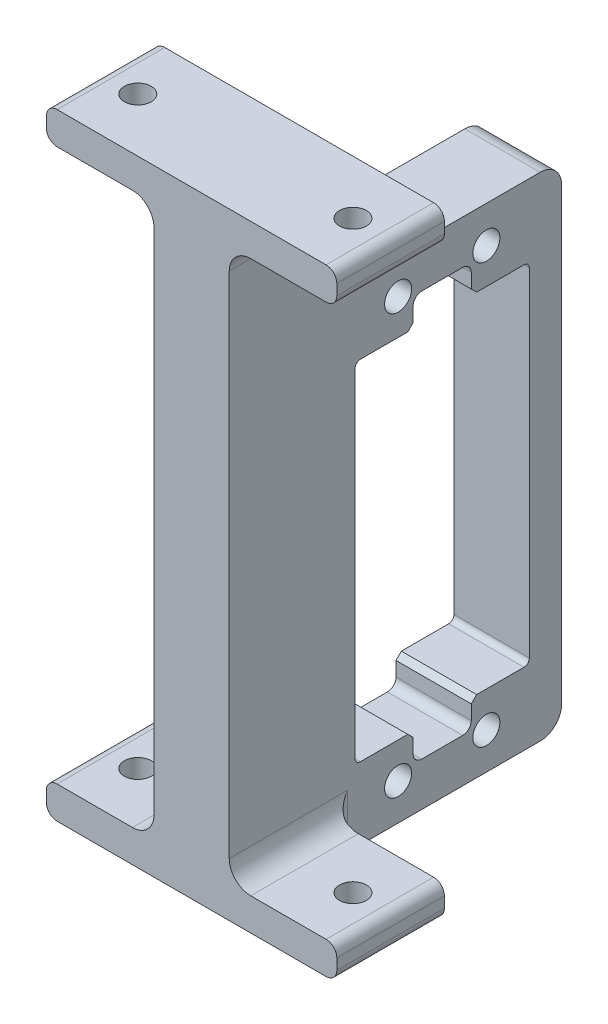
from build123d import *

# Parameters (mm, degrees)
FRAME_MOUNT_DEPTH         = 12.7
SKETCH3_R                 = 1.5875000000000008
SKETCH3_R_2               = 1.5875000000000024
MOUNT_HOLES_DEPTH         = 76.8344213797402
SKETCH4_W                 = 20.574
SKETCH4_H                 = 41.148
SERVO_MOUNT_FEATURE_DEPTH = 8.889999999999999
SKETCH5_R                 = 1.6001999999999992
SKETCH5_R_2               = 1.6001999999999998
SKETCH5_R_3               = 1.6002000000000005
SKETCH5_R_4               = 1.600200000000004
SERVO_MOUNT_HOLES_DEPTH   = 81.41316677012539
FILLET1_R                 = 2.54
FILLET2_R                 = 1.27
FILLET3_R                 = 0.635
FILLET4_R                 = 1.27
SKETCH6_W                 = 6.8580000000000005
SKETCH6_H                 = 3.352800000000009
SKETCH6_H_2               = 3.352800000000002
SERVOWIRE_GAP_DEPTH       = 81.41316677012539
FILLET5_R                 = 1.016
CHAMFER1_SIZE             = 0.635


with BuildPart() as part:
    # Sketch1 → Frame_Mount (new body)
    with BuildSketch(Plane.XY):
        Polygon((17.144999999999985, -4.04e-15), (-17.144999999999985, -4.04e-15), (-17.144999999999985, 3.809999999999992), (-4.444999999999985, 3.809999999999999), (-4.444999999999985, 68.96100000000001), (-17.144999999999985, 68.961), (-17.144999999999985, 72.77099999999999), (17.144999999999985, 72.77099999999999), (17.145000000000014, 68.961), (4.445000000000014, 68.961), (4.445000000000014, 3.809999999999999), (17.145000000000014, 3.8099999999999863), align=None)
    extrude(amount=FRAME_MOUNT_DEPTH)

    # Sketch3 → Mount_Holes (cut, through all)
    with BuildSketch(Plane.XZ):
        with Locations((12.7, 6.35)):
            Circle(SKETCH3_R)
        with Locations((-12.7, 6.35)):
            Circle(SKETCH3_R_2)
    extrude(amount=-MOUNT_HOLES_DEPTH, mode=Mode.SUBTRACT)

    # Sketch4 → Servo_Mount_Feature (add)
    with BuildSketch(Plane(origin=(4.445000000000014, 0, 0), x_dir=(0, 0, -1), z_dir=(1, 3.9e-16, 0))):
        Polygon((7.11e-15, 58.166000000000004), (26.543000000000006, 58.166), (26.543000000000006, -6.94e-15), (6.94e-15, -9.04e-15), align=None)
        with Locations((12.446000000000007, 29.082999999999995)):
            Rectangle(SKETCH4_W, SKETCH4_H, mode=Mode.SUBTRACT)
    extrude(amount=-SERVO_MOUNT_FEATURE_DEPTH)

    # Sketch5 → Servo_Mount_Holes (cut, through all)
    with BuildSketch(Plane(origin=(4.445000000000014, 0, 0), x_dir=(0, 0, -1), z_dir=(1, 3.9e-16, 0))):
        with Locations(Location((7.239000000000005, 53.84799999999999, 0), (0, 0, 90))):
            Circle(SKETCH5_R)
        with Locations((17.653000000000006, 53.84799999999999)):
            Circle(SKETCH5_R_2)
        with Locations(Location((17.653000000000006, 4.318000000000002, 0), (0, 0, 90))):
            Circle(SKETCH5_R_3)
        with Locations((7.239000000000006, 4.317999999999992)):
            Circle(SKETCH5_R_4)
    extrude(amount=-SERVO_MOUNT_HOLES_DEPTH, mode=Mode.SUBTRACT)

    # Fillet1
    fillet1_edges = [part.edges().sort_by_distance(p)[0] for p in [
        (-4.444999999999985, 3.809999999999999, 6.35),
        (-4.444999999999985, 68.96100000000001, 6.35),
        (4.445000000000014, 68.961, 6.35),
        (4.445000000000014, 3.809999999999999, 6.35),
        (-8.88e-15, 58.166000000000004, -7.11e-15),
        (-8.88e-15, 58.166, -26.543000000000006),
        (1.421e-14, -8.69e-15, -26.543000000000006),
    ]]
    fillet(fillet1_edges, radius=FILLET1_R)

    # Fillet2
    fillet2_edges = [part.edges().sort_by_distance(p)[0] for p in [
        (-4.444999999999986, 3.174999999999993, -3.47e-15),
        (4.445000000000013, 3.174999999999993, -3.47e-15),
    ]]
    fillet(fillet2_edges, radius=FILLET2_R)

    # Fillet3
    fillet3_edges = [part.edges().sort_by_distance(p)[0] for p in [
        (-5.33e-15, 49.65699999999999, -2.159000000000006),
        (-5.33e-15, 49.65699999999999, -22.733000000000008),
        (1.066e-14, 8.508999999999993, -22.733000000000008),
        (1.066e-14, 8.508999999999993, -2.159000000000006),
    ]]
    fillet(fillet3_edges, radius=FILLET3_R)

    # Fillet4
    fillet4_edges = [part.edges().sort_by_distance(p)[0] for p in [
        (-17.144999999999985, 3.809999999999992, 6.35),
        (-17.144999999999985, 68.961, 6.35),
        (-17.144999999999985, 72.77099999999999, 6.35),
        (17.144999999999985, 72.77099999999999, 6.35),
        (17.145000000000014, 68.961, 6.35),
        (17.145000000000014, 3.8099999999999863, 6.35),
        (17.144999999999985, -4.04e-15, 6.35),
        (-17.144999999999985, -4.04e-15, 6.35),
    ]]
    fillet(fillet4_edges, radius=FILLET4_R)

    # Sketch6 → ServoWire-Gap (cut, through all)
    with BuildSketch(Plane(origin=(4.445000000000014, 0, 0), x_dir=(0, 0, -1), z_dir=(1, 0, 0))):
        with Locations((12.446000000000007, 51.3334)):
            Rectangle(SKETCH6_W, SKETCH6_H)
        with Locations((12.446000000000007, 6.832599999999994)):
            Rectangle(SKETCH6_W, SKETCH6_H_2)
    extrude(amount=-SERVOWIRE_GAP_DEPTH, mode=Mode.SUBTRACT)

    # Fillet5
    fillet5_edges = [part.edges().sort_by_distance(p)[0] for p in [
        (3.55e-15, 53.009800000000006, -9.017000000000007),
        (3.55e-15, 53.009800000000006, -15.875000000000007),
        (1.332e-14, 5.156199999999993, -15.875000000000007),
        (1.332e-14, 5.156199999999993, -9.017000000000007),
    ]]
    fillet(fillet5_edges, radius=FILLET5_R)

    # Chamfer1
    chamfer1_edges = [part.edges().sort_by_distance(p)[0] for p in [
        (1.243e-14, 8.508999999999995, -9.017000000000007),
        (1.243e-14, 8.508999999999995, -15.875000000000007),
        (4.44e-15, 49.657, -9.017000000000007),
        (4.44e-15, 49.657, -15.875000000000007),
    ]]
    chamfer(chamfer1_edges, length=CHAMFER1_SIZE)


solid = part.part
